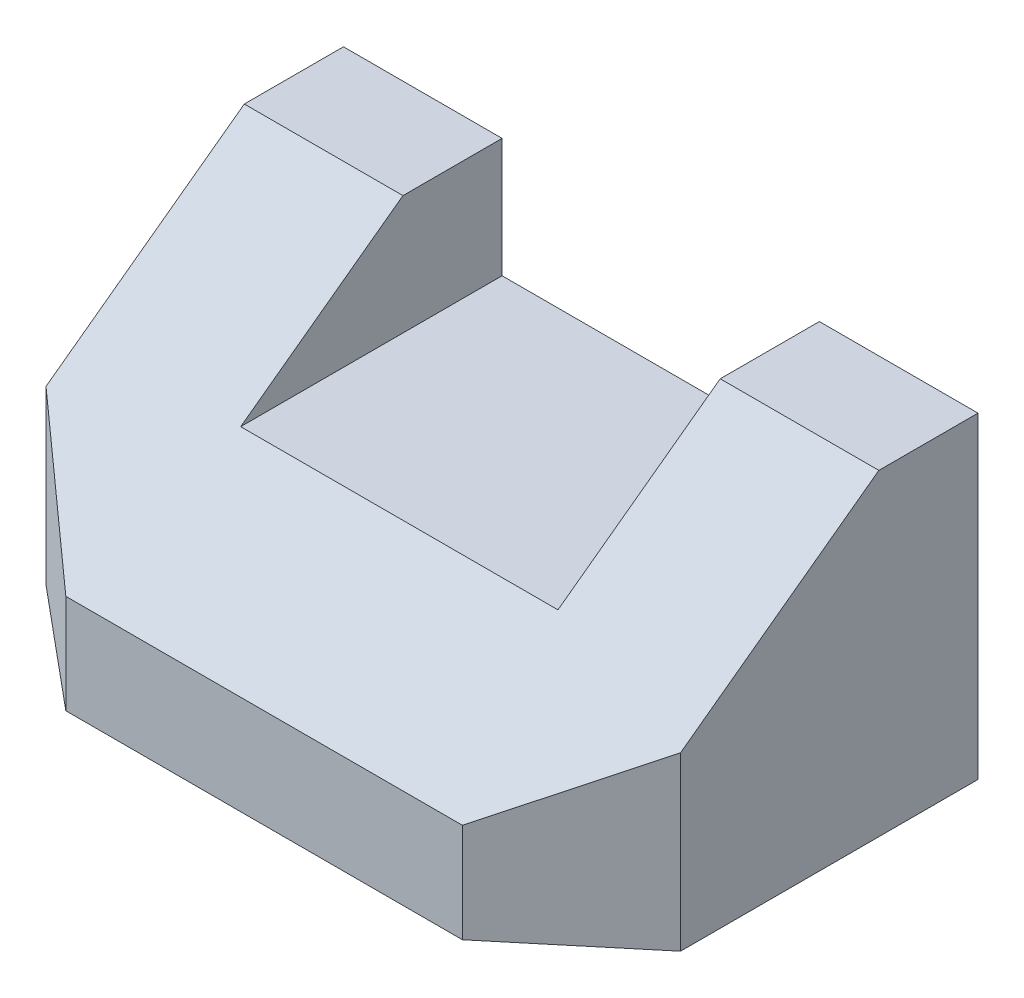
from build123d import *

# Parameters (mm, degrees)
EXTRUDE_1_DEPTH     = 32
SKETCH_2_W          = 32
SKETCH_2_H          = 12
CUT_EXTRUDE_2_DEPTH = 61.398675482
CUT_EXTRUDE_3_DEPTH = 61.398675482


with BuildPart() as part:
    # 草圖1 → 伸長1 (new, symmetric)
    with BuildSketch(Plane(origin=(0, 0, 0), x_dir=(0, 0, -1), z_dir=(1, 0, 0))):
        Polygon((0, 0), (0, 10), (30, 32), (40, 32), (40, 0), align=None)
    extrude(amount=EXTRUDE_1_DEPTH, both=True)

    # 草圖2 → 伸長2 (cut, through all)
    with BuildSketch(Plane(origin=(0, 0, 0), x_dir=(-1, 0, 0), z_dir=(0, 0, -1))):
        with Locations((0, 26)):
            Rectangle(SKETCH_2_W, SKETCH_2_H)
    extrude(amount=CUT_EXTRUDE_2_DEPTH, mode=Mode.SUBTRACT)

    # 草圖3 → 伸長3 (cut, through all)
    with BuildSketch(Plane.XZ):
        Polygon((-32, -10), (-32, 0), (-20, 0), align=None)
        Polygon((32, -10), (32, 0), (20, 0), align=None)
    extrude(amount=-CUT_EXTRUDE_3_DEPTH, mode=Mode.SUBTRACT)


solid = part.part
